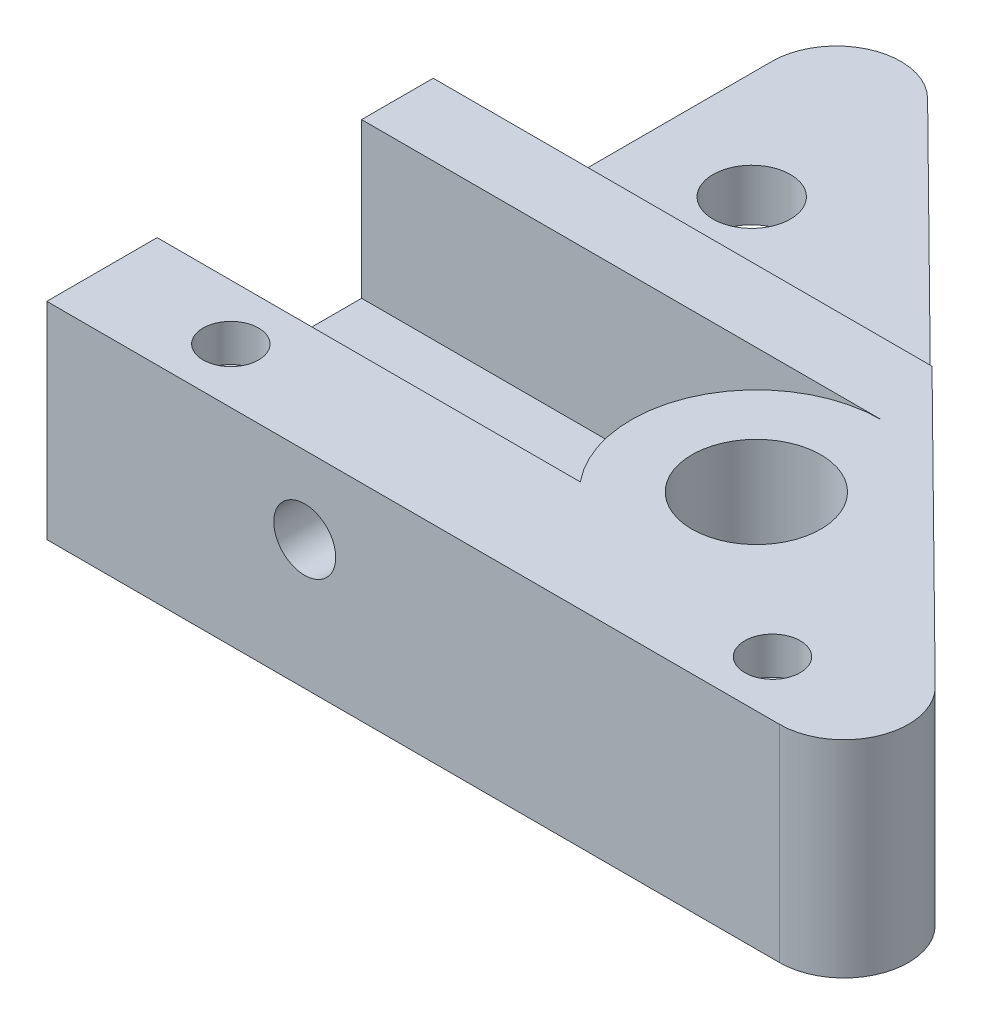
from build123d import *

# Parameters (mm, degrees)
SKETCH1_R           = 3
SKETCH1_R_2         = 5
BOSS_EXTRUDE1_DEPTH = 4
FILLET1_R           = 5
SKETCH2_R           = 5
BOSS_EXTRUDE2_DEPTH = 12
SKETCH4_R           = 2.401871641
CUT_EXTRUDE2_DEPTH  = 30
SKETCH6_R           = 2.15
CUT_EXTRUDE3_DEPTH  = 2.9


with BuildPart() as part:
    # Sketch1 → Boss-Extrude1 (new body)
    with BuildSketch(Plane(origin=(0, 0, 0), x_dir=(1, 0, 0), z_dir=(0, 1, 0))):
        Polygon((-5.790326763, 58.347363117), (-5.790326763, -9.85213545), (63.193084095, -9.85213545), align=None)
        with Locations(Location((2.52138652, 36.496379496, 0), (0, 0, 270))):
            Circle(SKETCH1_R, mode=Mode.SUBTRACT)
        with Locations(Location((34.519986489, 4.856379496, 0), (0, 0, 270))):
            Circle(SKETCH1_R_2, mode=Mode.SUBTRACT)
    extrude(amount=BOSS_EXTRUDE1_DEPTH)

    # Fillet1
    fillet1_edges = [part.edges().sort_by_distance(p)[0] for p in [
        (63.193084095, 2, 9.85213545),
        (-5.790326763, 2, -58.347363117),
    ]]
    fillet(fillet1_edges, radius=FILLET1_R)

    # Sketch2 → Boss-Extrude2 (add)
    # profile 1 of 5: a face of its own
    with BuildSketch(Plane(origin=(0, 4, 0), x_dir=(1, 0, 0), z_dir=(0, 1, 0))):
        with BuildLine():
            Line((42.017536623, -1.29645629), (54.539062539, -1.29645629))
            Line((54.539062539, -1.29645629), (41.338915092, 11.753687589))
            ThreePointArc((41.338915092, 11.753687589), (43.470054942, 8.593613888), (44.21898882, 4.856379496))
            ThreePointArc((44.21898882, 4.856379496), (43.65205642, 1.588973033), (42.017536623, -1.29645629))
        make_face()
    # profile 2 of 5: a face of its own
    with BuildSketch(Plane(origin=(0, 4, 0), x_dir=(1, 0, 0), z_dir=(0, 1, 0))):
        with BuildLine():
            ThreePointArc((51.023789334, -9.85213545), (55.648635051, -6.752346517), (54.539062539, -1.29645629))
            Line((54.539062539, -1.29645629), (42.017536623, -1.29645629))
            ThreePointArc((42.017536623, -1.29645629), (34.519986489, -4.842622834), (27.022436356, -1.29645629))
            Line((27.022436356, -1.29645629), (-5.790326763, -1.29645629))
            Line((-5.790326763, -1.29645629), (-5.790326763, -9.85213545))
            Line((-5.790326763, -9.85213545), (51.023789334, -9.85213545))
        make_face()
    # profile 3 of 5: a face of its own
    with BuildSketch(Plane(origin=(0, 4, 0), x_dir=(1, 0, 0), z_dir=(0, 1, 0))):
        with BuildLine():
            ThreePointArc((27.022436356, -1.29645629), (34.519986489, -4.842622834), (42.017536623, -1.29645629))
            Line((42.017536623, -1.29645629), (27.022436356, -1.29645629))
        make_face()
    # profile 4 of 5: a face of its own
    with BuildSketch(Plane(origin=(0, 4, 0), x_dir=(1, 0, 0), z_dir=(0, 1, 0))):
        with BuildLine():
            ThreePointArc((34.519986489, 14.555381827), (38.206016803, 13.827657373), (41.338915092, 11.753687589))
            Line((41.338915092, 11.753687589), (32.887372323, 20.109188887))
            Line((32.887372323, 20.109188887), (-5.790326763, 20.109188887))
            Line((-5.790326763, 20.109188887), (-5.790326763, 14.555381827))
            Line((-5.790326763, 14.555381827), (34.519986489, 14.555381827))
        make_face()
    # profile 5 of 5: a face of its own
    with BuildSketch(Plane(origin=(0, 4, 0), x_dir=(1, 0, 0), z_dir=(0, 1, 0))):
        with BuildLine():
            Line((27.022436356, -1.29645629), (42.017536623, -1.29645629))
            ThreePointArc((42.017536623, -1.29645629), (43.65205642, 1.588973033), (44.21898882, 4.856379496))
            ThreePointArc((44.21898882, 4.856379496), (43.470054942, 8.593613888), (41.338915092, 11.753687589))
            ThreePointArc((41.338915092, 11.753687589), (38.206016803, 13.827657373), (34.519986489, 14.555381827))
            ThreePointArc((34.519986489, 14.555381827), (25.752232648, 9.003322803), (27.022436356, -1.29645629))
        make_face()
        with Locations(Location((34.519986489, 4.856379496, 0), (0, 0, 270))):
            Circle(SKETCH2_R, mode=Mode.SUBTRACT)
    extrude(amount=BOSS_EXTRUDE2_DEPTH)

    # Sketch4 → Cut-Extrude2 (cut)
    with BuildSketch(Plane(origin=(0, 0, 1.29645629), x_dir=(-1, 0, 0), z_dir=(0, 0, -1))):
        with Locations((-14.209673237, 10)):
            Circle(SKETCH4_R)
    extrude(amount=-CUT_EXTRUDE2_DEPTH, mode=Mode.SUBTRACT)

    # Sketch6 → Cut-Extrude3 (cut)
    with BuildSketch(Plane(origin=(0, 16, 0), x_dir=(1, 0, 0), z_dir=(0, 1, 0))):
        with Locations(Location((46.209673237, -5.58213545, 0), (0, 0, 270))):
            Circle(SKETCH6_R)
        with Locations(Location((4.209673237, -5.58213545, 0), (0, 0, 270))):
            Circle(SKETCH6_R)
    extrude(amount=-CUT_EXTRUDE3_DEPTH, mode=Mode.SUBTRACT)


solid = part.part
